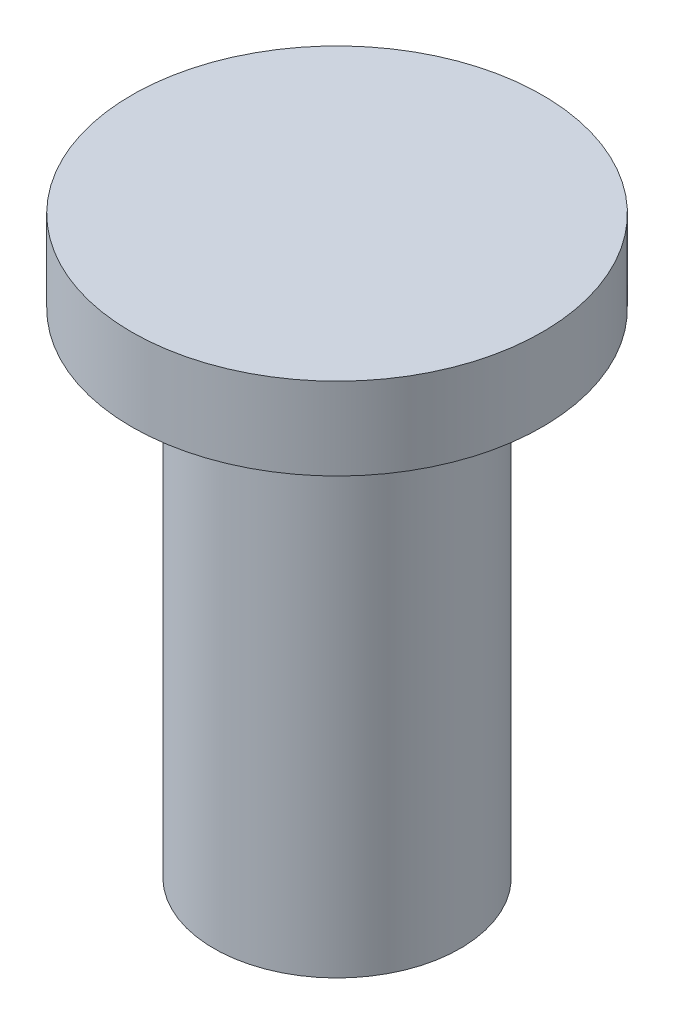
from build123d import *

# Parameters (mm, degrees)
SKETCH_1_R      = 2.5
EXTRUDE_1_DEPTH = 1
SKETCH_2_R      = 1.5
EXTRUDE_2_DEPTH = 6


with BuildPart() as part:
    # 草图1 → 凸台-拉伸1 (new body)
    with BuildSketch(Plane(origin=(0, 0, 0), x_dir=(1, 0, 0), z_dir=(0, 1, 0))):
        with Locations(Location((0, 0, 0), (0, 0, 270))):
            Circle(SKETCH_1_R)
    extrude(amount=EXTRUDE_1_DEPTH)

    # 草图2 → 凸台-拉伸2 (add)
    with BuildSketch(Plane.XZ):
        with Locations(Location((0, 0, 0), (0, 0, 270))):
            Circle(SKETCH_2_R)
    extrude(amount=EXTRUDE_2_DEPTH)


solid = part.part
